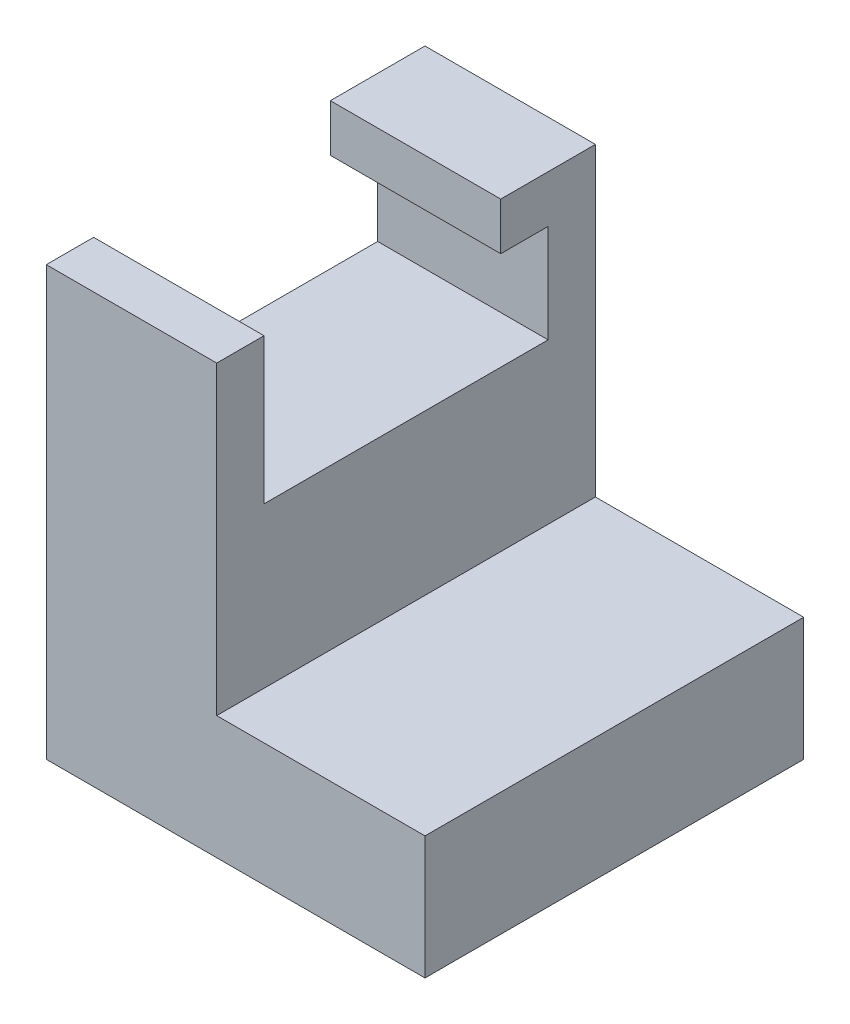
from build123d import *

# Parameters (mm, degrees)
BOSS_EXTRUDE1_DEPTH = 40
SKETCH2_W           = 25
SKETCH2_H           = 5
CUT_EXTRUDE1_DEPTH  = 40
SKETCH3_W           = 30
SKETCH3_H           = 10.379013983
CUT_EXTRUDE2_DEPTH  = 40


with BuildPart() as part:
    # Sketch1 → Boss-Extrude1 (new body)
    with BuildSketch(Plane.XY):
        Polygon((-17.254373504, 42.068083371), (-35.254373504, 42.068083371), (-35.254373504, -3.181916629), (4.745626496, -3.181916629), (4.745626496, 9.818083371), (-17.254373504, 9.818083371), align=None)
    extrude(amount=BOSS_EXTRUDE1_DEPTH)

    # Sketch2 → Cut-Extrude1 (cut)
    with BuildSketch(Plane(origin=(-17.254373504, 0, 0), x_dir=(0, 0, -1), z_dir=(1, 0, 0))):
        with Locations((-22.5, 39.568083371)):
            Rectangle(SKETCH2_W, SKETCH2_H)
    extrude(amount=-CUT_EXTRUDE1_DEPTH, mode=Mode.SUBTRACT)

    # Sketch3 → Cut-Extrude2 (cut)
    with BuildSketch(Plane(origin=(-17.254373504, 0, 0), x_dir=(0, 0, -1), z_dir=(1, 0, 0))):
        with Locations((-20, 31.87857638)):
            Rectangle(SKETCH3_W, SKETCH3_H)
    extrude(amount=-CUT_EXTRUDE2_DEPTH, mode=Mode.SUBTRACT)


solid = part.part
